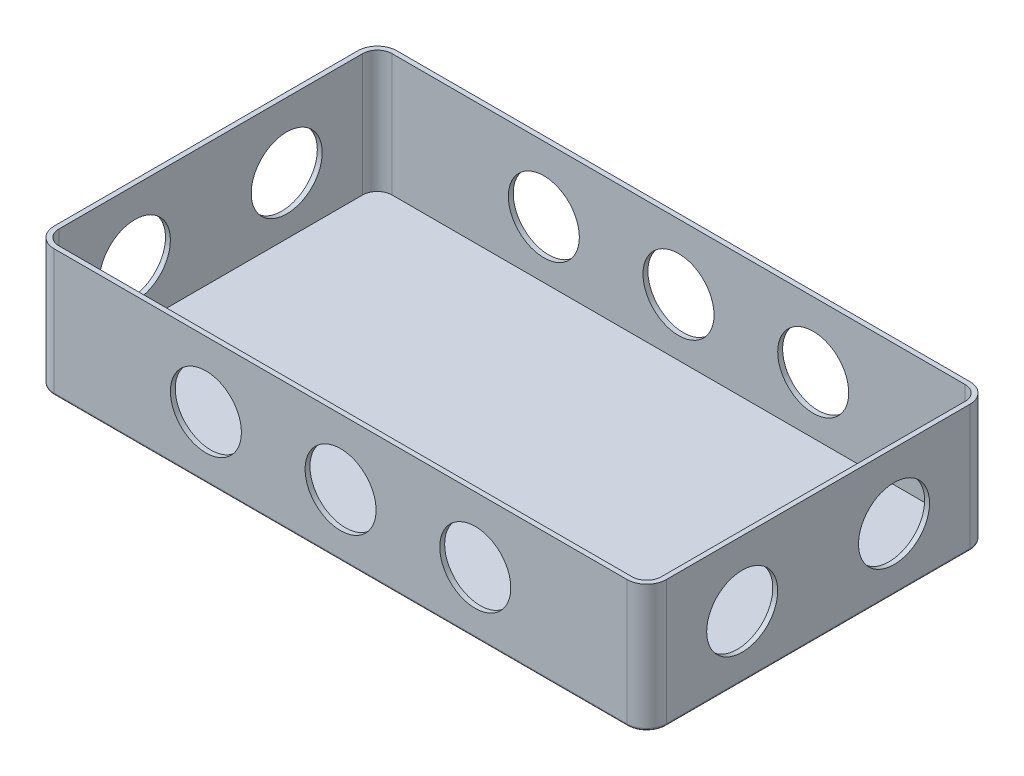
from build123d import *

# Parameters (mm, degrees)
BOSS_EXTRUDE1_DEPTH     = 52
FILLET1_R               = 1
SHELL1_T                = -2
SKETCH2_R               = 9
SKETCH2_R_2             = 4
BOSS_EXTRUDE2_DEPTH     = 2.5
SKETCH3_R               = 14.5
CUT_EXTRUDE1_DEPTH      = 195.753690594
CUT_EXTRUDE2_DEPTH      = 153.410629551
CUT_EXTRUDE2_DEPTH_BACK = 153.410629551
SKETCH4_R               = 14.5


with BuildPart() as part:
    # Sketch1 → Boss-Extrude1 (new body)
    with BuildSketch(Plane(origin=(0, 0, 0), x_dir=(1, 0, 0), z_dir=(0, 1, 0))):
        with BuildLine():
            Line((125, -62), (125, 62))
            ThreePointArc((125, 62), (122.656854249, 67.656854249), (117, 70))
            Line((117, 70), (-117, 70))
            ThreePointArc((-117, 70), (-122.656854249, 67.656854249), (-125, 62))
            Line((-125, 62), (-125, -62))
            ThreePointArc((-125, -62), (-122.656854249, -67.656854249), (-117, -70))
            Line((-117, -70), (117, -70))
            ThreePointArc((117, -70), (122.656854249, -67.656854249), (125, -62))
        make_face()
    extrude(amount=BOSS_EXTRUDE1_DEPTH)

    # Fillet1
    fillet1_edges = [part.edges().sort_by_distance(p)[0] for p in [
        (0, 0, -70),
        (122.656854249, 0, -67.656854249),
        (125, 0, 0),
        (122.656854249, 0, 67.656854249),
        (0, 0, 70),
        (-122.656854249, 0, 67.656854249),
        (-125, 0, 0),
        (-122.656854249, 0, -67.656854249),
    ]]
    fillet(fillet1_edges, radius=FILLET1_R)

    # Shell1
    shell1_openings = [part.faces().sort_by_distance(p)[0] for p in [
        (0, 52, 0),
    ]]
    offset(amount=SHELL1_T, openings=shell1_openings, kind=Kind.INTERSECTION)

    # Sketch2 → Boss-Extrude2 (add)
    # profile 1 of 4: a face of its own
    with BuildSketch(Plane.XZ):
        with Locations(Location((76, 51, 0), (0, 0, 90))):
            Circle(SKETCH2_R)
        with Locations(Location((76, 51, 0), (0, 0, 270))):
            Circle(SKETCH2_R_2, mode=Mode.SUBTRACT)
    # profile 2 of 4: a face of its own
    with BuildSketch(Plane.XZ):
        with Locations(Location((76, -51, 0), (0, 0, 90))):
            Circle(SKETCH2_R)
        with Locations(Location((76, -51, 0), (0, 0, 90))):
            Circle(SKETCH2_R_2, mode=Mode.SUBTRACT)
    # profile 3 of 4: a face of its own
    with BuildSketch(Plane.XZ):
        with Locations(Location((-76, -51, 0), (0, 0, 90))):
            Circle(SKETCH2_R)
        with Locations(Location((-76, -51, 0), (0, 0, 270))):
            Circle(SKETCH2_R_2, mode=Mode.SUBTRACT)
    # profile 4 of 4: a face of its own
    with BuildSketch(Plane.XZ):
        with Locations(Location((-76, 51, 0), (0, 0, 90))):
            Circle(SKETCH2_R)
        with Locations(Location((-76, 51, 0), (0, 0, 90))):
            Circle(SKETCH2_R_2, mode=Mode.SUBTRACT)
    extrude(amount=BOSS_EXTRUDE2_DEPTH)

    # Sketch3 → Cut-Extrude1 (cut, through all)
    with BuildSketch(Plane(origin=(0, 0, -70), x_dir=(-1, 0, 0), z_dir=(0, 0, -1))):
        with Locations((-55, 25.3)):
            Circle(SKETCH3_R)
        with Locations((0, 25.3)):
            Circle(SKETCH3_R)
        with Locations((55, 25.3)):
            Circle(SKETCH3_R)
    extrude(amount=-CUT_EXTRUDE1_DEPTH, mode=Mode.SUBTRACT)

    # Sketch4 → Cut-Extrude2 (cut, two sides: drawn at the far end of the back side and taken through both)
    with BuildSketch(Plane(origin=(0, 0, 0), x_dir=(0, 0, -1), z_dir=(1, 0, 0)).offset(-CUT_EXTRUDE2_DEPTH_BACK)):
        with Locations((31, 25.3)):
            Circle(SKETCH4_R)
        with Locations(Location((-31, 25.3, 0), (0, 0, 180))):
            Circle(SKETCH4_R)
    extrude(amount=CUT_EXTRUDE2_DEPTH + CUT_EXTRUDE2_DEPTH_BACK, mode=Mode.SUBTRACT)


solid = part.part
